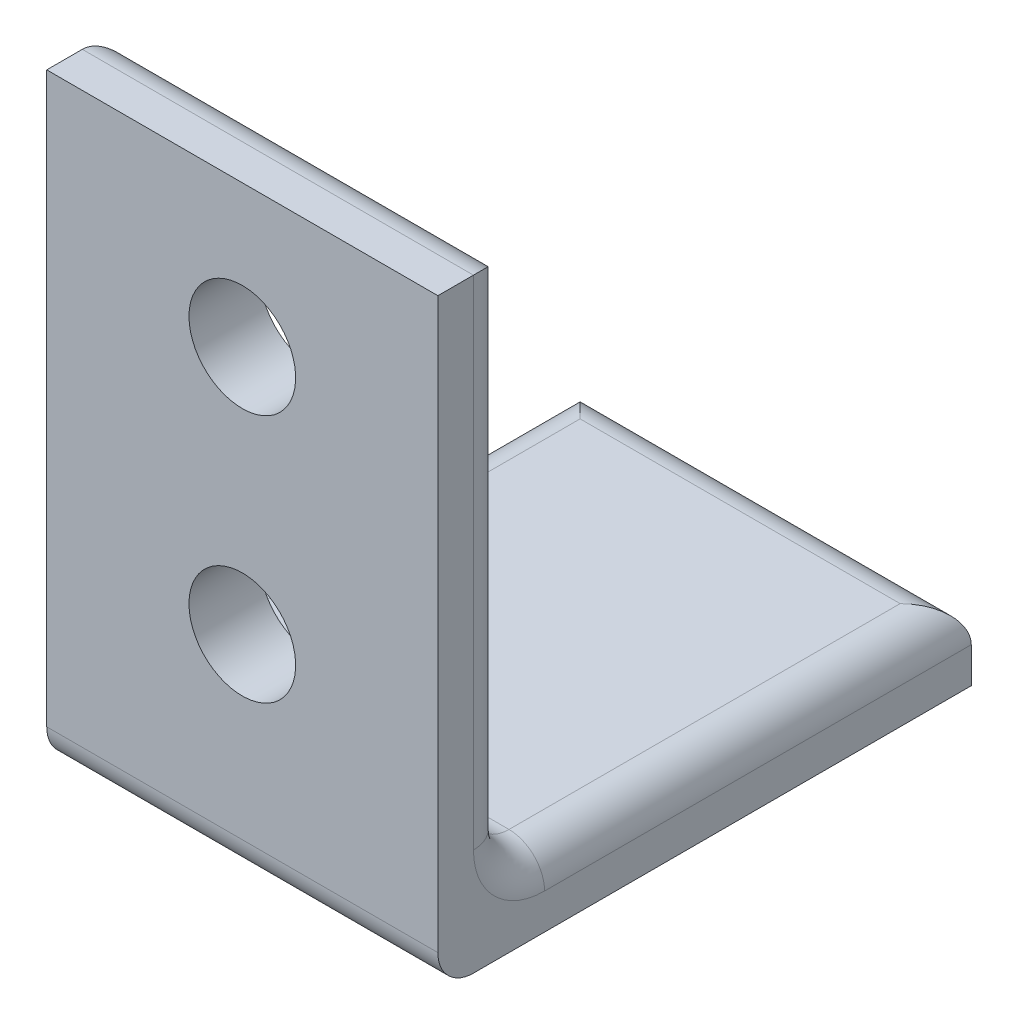
from build123d import *

# Parameters (mm, degrees)
ESBO_O1_W                = 11
ESBO_O1_H                = 19
RESSALTO_EXTRUS_O1_DEPTH = 2
ESBO_O2_W                = 11
ESBO_O2_H                = 2
RESSALTO_EXTRUS_O2_DEPTH = 15
ESBO_O3_R                = 1.5
CORTE_EXTRUS_O1_DEPTH    = 15
ESBO_O4_W                = 11
ESBO_O4_H                = 4
CORTE_EXTRUS_O2_DEPTH    = 15
FILETE1_R                = 1
FILETE2_R                = 1


with BuildPart() as part:
    # Esboço1 → Ressalto-extrusão1 (new body)
    with BuildSketch(Plane(origin=(0, 0, 0), x_dir=(1, 0, 0), z_dir=(0, 1, 0))):
        with Locations((-25.942415051, -17.124578687)):
            Rectangle(ESBO_O1_W, ESBO_O1_H)
    extrude(amount=RESSALTO_EXTRUS_O1_DEPTH)

    # Esboço2 → Ressalto-extrusão2 (add)
    with BuildSketch(Plane(origin=(0, 2, 0), x_dir=(1, 0, 0), z_dir=(0, 1, 0))):
        with Locations((-25.942415051, -25.624578687)):
            Rectangle(ESBO_O2_W, ESBO_O2_H)
    extrude(amount=RESSALTO_EXTRUS_O2_DEPTH)

    # Esboço3 → Corte-extrusão1 (cut)
    with BuildSketch(Plane(origin=(0, 0, 24.624578687), x_dir=(-1, 0, 0), z_dir=(0, 0, -1))):
        with Locations((25.942415051, 6)):
            Circle(ESBO_O3_R)
        with Locations((25.942415051, 13)):
            Circle(ESBO_O3_R)
    extrude(amount=-CORTE_EXTRUS_O1_DEPTH, mode=Mode.SUBTRACT)

    # Esboço4 → Corte-extrusão2 (cut)
    with BuildSketch(Plane(origin=(0, 2, 0), x_dir=(1, 0, 0), z_dir=(0, 1, 0))):
        with Locations((-25.942415051, -9.624578687)):
            Rectangle(ESBO_O4_W, ESBO_O4_H)
    extrude(amount=-CORTE_EXTRUS_O2_DEPTH, mode=Mode.SUBTRACT)

    # Filete1
    filete1_edges = [part.edges().sort_by_distance(p)[0] for p in [
        (-25.942415051, 2, 24.624578687),
        (-25.942415051, 0, 26.624578687),
    ]]
    fillet(filete1_edges, radius=FILETE1_R)

    # Filete2
    filete2_edges = [part.edges().sort_by_distance(p)[0] for p in [
        (-31.442415051, 10, 24.624578687),
        (-20.442415051, 10, 24.624578687),
        (-25.942415051, 17, 24.624578687),
        (-31.442415051, 2, 17.624578687),
        (-25.942415051, 2, 11.624578687),
        (-20.442415051, 2, 17.624578687),
        (-31.442415051, 2.292893219, 24.331685469),
        (-20.442415051, 2.292893219, 24.331685469),
    ]]
    fillet(filete2_edges, radius=FILETE2_R)


solid = part.part
